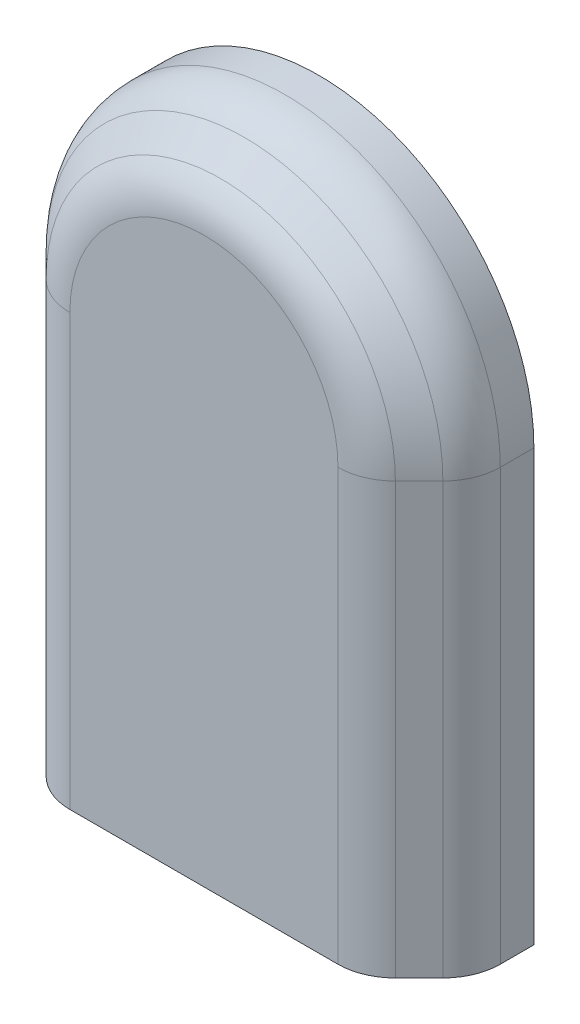
from build123d import *

# Parameters (mm, degrees)
BOSS_EXTRUDE1_DEPTH = 20
CHAMFER1_SIZE       = 10
FILLET1_R           = 10
FILLET2_R           = 10
SKETCH9_W           = 105
SKETCH9_H           = 30
CUT_EXTRUDE2_DEPTH  = 109.656569187


with BuildPart() as part:
    # Sketch1 → Boss-Extrude1 (new body)
    with BuildSketch(Plane.XY):
        with BuildLine():
            Line((-37.5, 0), (-37.5, -100))
            Line((-37.5, -100), (37.5, -100))
            Line((37.5, -100), (37.5, 0))
            ThreePointArc((37.5, 0), (0, 37.5), (-37.5, 0))
        make_face()
    extrude(amount=BOSS_EXTRUDE1_DEPTH)

    # Chamfer1
    chamfer1_edges = [part.edges().sort_by_distance(p)[0] for p in [
        (-37.5, -50, 20),
        (0, 37.5, 20),
        (37.5, -50, 20),
    ]]
    chamfer(chamfer1_edges, length=CHAMFER1_SIZE)

    # Fillet1
    fillet1_edges = [part.edges().sort_by_distance(p)[0] for p in [
        (-27.5, -50, 20),
        (0, 27.5, 20),
        (27.5, -50, 20),
    ]]
    fillet(fillet1_edges, radius=FILLET1_R)

    # Fillet2
    fillet2_edges = [part.edges().sort_by_distance(p)[0] for p in [
        (37.5, -50, 10),
        (0, 37.5, 10),
        (-37.5, -50, 10),
    ]]
    fillet(fillet2_edges, radius=FILLET2_R)

    # Sketch9 → Cut-Extrude2 (cut, through all)
    with BuildSketch(Plane(origin=(0, 0, 0), x_dir=(-1, 0, 0), z_dir=(0, 0, -1))):
        with Locations((0, -90)):
            Rectangle(SKETCH9_W, SKETCH9_H)
    extrude(amount=-CUT_EXTRUDE2_DEPTH, mode=Mode.SUBTRACT)


solid = part.part
